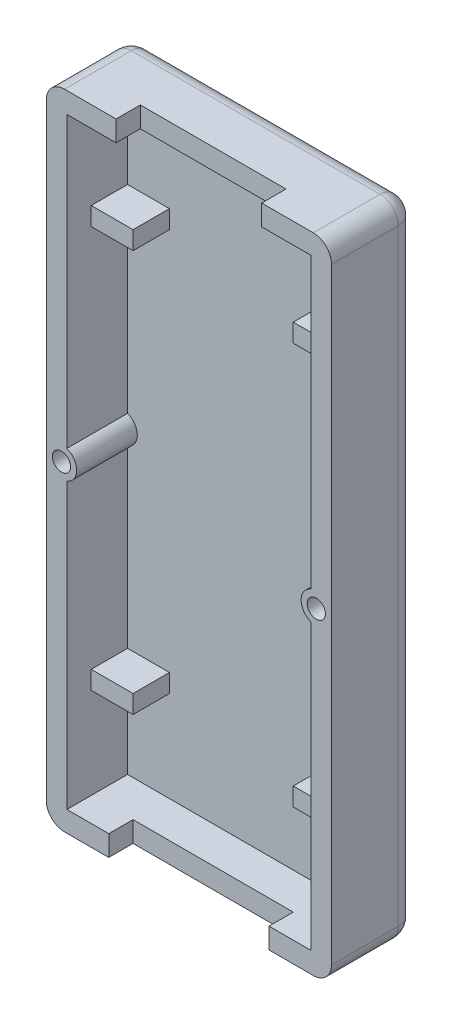
from build123d import *

# Parameters (mm, degrees)
SKETCH_1_W          = 23.5
SKETCH_1_H          = 53
EXTRUDE_1_DEPTH     = 7
EXTRUDE_2_DEPTH     = 2
SKETCH_2_W          = 3.45
SKETCH_2_H          = 1.5
EXTRUDE_3_DEPTH     = 3
SKETCH_3_R          = 0.75
SKETCH_3_W          = 13.2
SKETCH_3_H          = 1.7
SKETCH_3_W_2        = 12
CUT_EXTRUDE_1_DEPTH = 2
FILLET_1_R          = 1.5
FILLET_2_R          = 1.5


with BuildPart() as part:
    # 草图1 → 凸台-拉伸1 (new body)
    with BuildSketch(Plane.XY):
        with Locations((11.75, -26.5)):
            Rectangle(SKETCH_1_W, SKETCH_1_H)
        with BuildLine():
            Line((21.8, -1.7), (21.8, -25.533809621))
            ThreePointArc((21.8, -25.533809621), (21, -26.7), (21.8, -27.866190379))
            Line((21.8, -27.866190379), (21.8, -51.3))
            Line((21.8, -51.3), (1.7, -51.3))
            Line((1.7, -51.3), (1.7, -27.866190379))
            ThreePointArc((1.7, -27.866190379), (2.5, -26.7), (1.7, -25.533809621))
            Line((1.7, -25.533809621), (1.7, -1.7))
            Line((1.7, -1.7), (21.8, -1.7))
        make_face(mode=Mode.SUBTRACT)
    extrude(amount=EXTRUDE_1_DEPTH)

    # 草图1<2> → 凸台-拉伸2 (add)
    with BuildSketch(Plane.XY):
        with BuildLine():
            Line((1.7, -1.7), (1.7, -25.533809621))
            ThreePointArc((1.7, -25.533809621), (2.280776406, -25.992893219), (2.5, -26.7))
            ThreePointArc((2.5, -26.7), (2.280776406, -27.407106781), (1.7, -27.866190379))
            Line((1.7, -27.866190379), (1.7, -51.3))
            Line((1.7, -51.3), (21.8, -51.3))
            Line((21.8, -51.3), (21.8, -27.866190379))
            ThreePointArc((21.8, -27.866190379), (21, -26.7), (21.8, -25.533809621))
            Line((21.8, -25.533809621), (21.8, -1.7))
            Line((21.8, -1.7), (1.7, -1.7))
        make_face()
    extrude(amount=EXTRUDE_2_DEPTH)

    # 草图2 → 凸台-拉伸3 (add)
    with BuildSketch(Plane.XY.offset(2)):
        with Locations((3.425, -43.05)):
            Rectangle(SKETCH_2_W, SKETCH_2_H)
        with Locations((20.075, -43.05)):
            Rectangle(SKETCH_2_W, SKETCH_2_H)
        with Locations((3.425, -9.95)):
            Rectangle(SKETCH_2_W, SKETCH_2_H)
        with Locations((20.075, -9.95)):
            Rectangle(SKETCH_2_W, SKETCH_2_H)
    extrude(amount=EXTRUDE_3_DEPTH)

    # 草图3 → 切除-拉伸1 (cut)
    with BuildSketch(Plane.XY.offset(7)):
        with Locations((22.25, -26.7)):
            Circle(SKETCH_3_R)
        with Locations((1.25, -26.7)):
            Circle(SKETCH_3_R)
        with Locations((11.75, -52.15)):
            Rectangle(SKETCH_3_W, SKETCH_3_H)
        with Locations((11.75, -0.85)):
            Rectangle(SKETCH_3_W_2, SKETCH_3_H)
    extrude(amount=-CUT_EXTRUDE_1_DEPTH, mode=Mode.SUBTRACT)

    # 圆角1
    fillet_1_edges = [part.edges().sort_by_distance(p)[0] for p in [
        (0, 0, 3.5),
        (23.5, 0, 3.5),
        (23.5, -53, 3.5),
        (0, -53, 3.5),
    ]]
    fillet(fillet_1_edges, radius=FILLET_1_R)

    # 圆角2
    fillet_2_edges = [part.edges().sort_by_distance(p)[0] for p in [
        (0.439339828, -0.439339828, 0),
        (11.75, 0, 0),
        (23.060660172, -0.439339828, 0),
        (23.5, -26.5, 0),
        (23.060660172, -52.560660172, 0),
        (11.75, -53, 0),
        (0.439339828, -52.560660172, 0),
        (0, -26.5, 0),
    ]]
    fillet(fillet_2_edges, radius=FILLET_2_R)


solid = part.part
